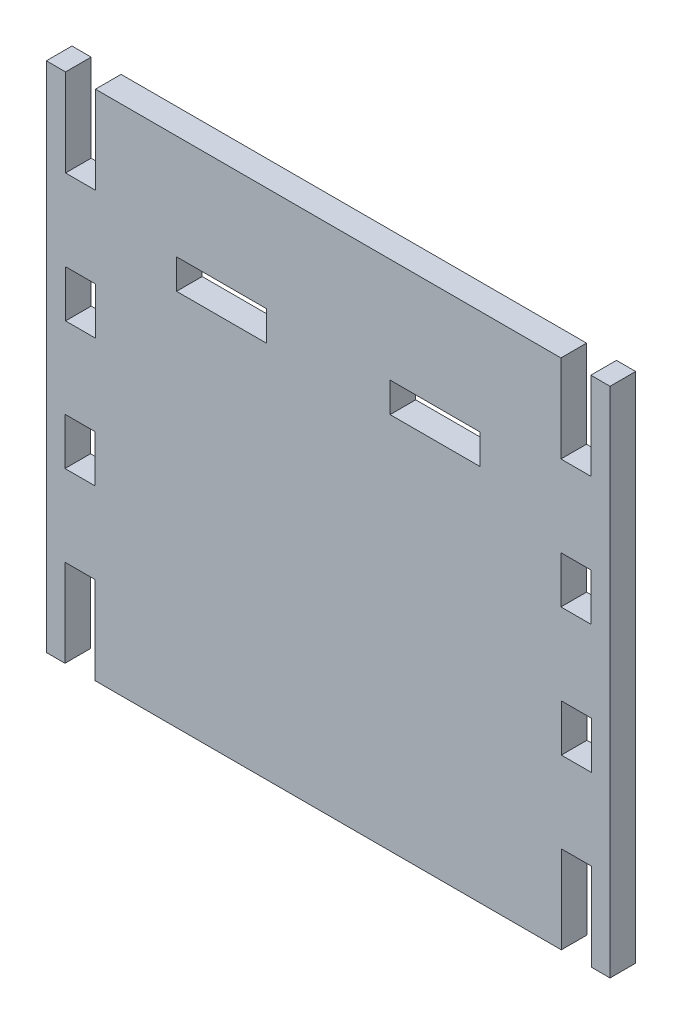
from build123d import *

# Parameters (mm, degrees)
SKETCH_1_W      = 10.5
SKETCH_1_H      = 3.5
SKETCH_1_W_2    = 3.5
SKETCH_1_H_2    = 5.5
SKETCH_1_W_3    = 3.520169939
EXTRUDE_1_DEPTH = 3


with BuildPart() as part:
    # Эскиз1 → Бобышка-Вытянуть1 (new body)
    with BuildSketch(Plane.XY):
        Polygon((-27.25, 30), (27.25, 30), (27.25, 19.75), (30.75, 19.75), (30.75, 30), (33, 30), (33, -30), (30.816819074, -30), (30.816819074, -19.75), (27.296649135, -19.75), (27.296649135, -30), (-27.296649135, -30), (-27.296649135, -19.75), (-30.816819074, -19.75), (-30.816819074, -30), (-33, -30), (-33, 30), (-30.75, 30), (-30.75, 19.75), (-27.25, 19.75), align=None)
        with Locations((-12.5, 16)):
            Rectangle(SKETCH_1_W, SKETCH_1_H, mode=Mode.SUBTRACT)
        with Locations((-29, 7.5)):
            Rectangle(SKETCH_1_W_2, SKETCH_1_H_2, mode=Mode.SUBTRACT)
        with Locations((-29.056734105, -7.5)):
            Rectangle(SKETCH_1_W_3, SKETCH_1_H_2, mode=Mode.SUBTRACT)
        with Locations((29.056734105, -7.5)):
            Rectangle(SKETCH_1_W_3, SKETCH_1_H_2, mode=Mode.SUBTRACT)
        with Locations((29, 7.5)):
            Rectangle(SKETCH_1_W_2, SKETCH_1_H_2, mode=Mode.SUBTRACT)
        with Locations((12.5, 16)):
            Rectangle(SKETCH_1_W, SKETCH_1_H, mode=Mode.SUBTRACT)
    extrude(amount=EXTRUDE_1_DEPTH)


solid = part.part
